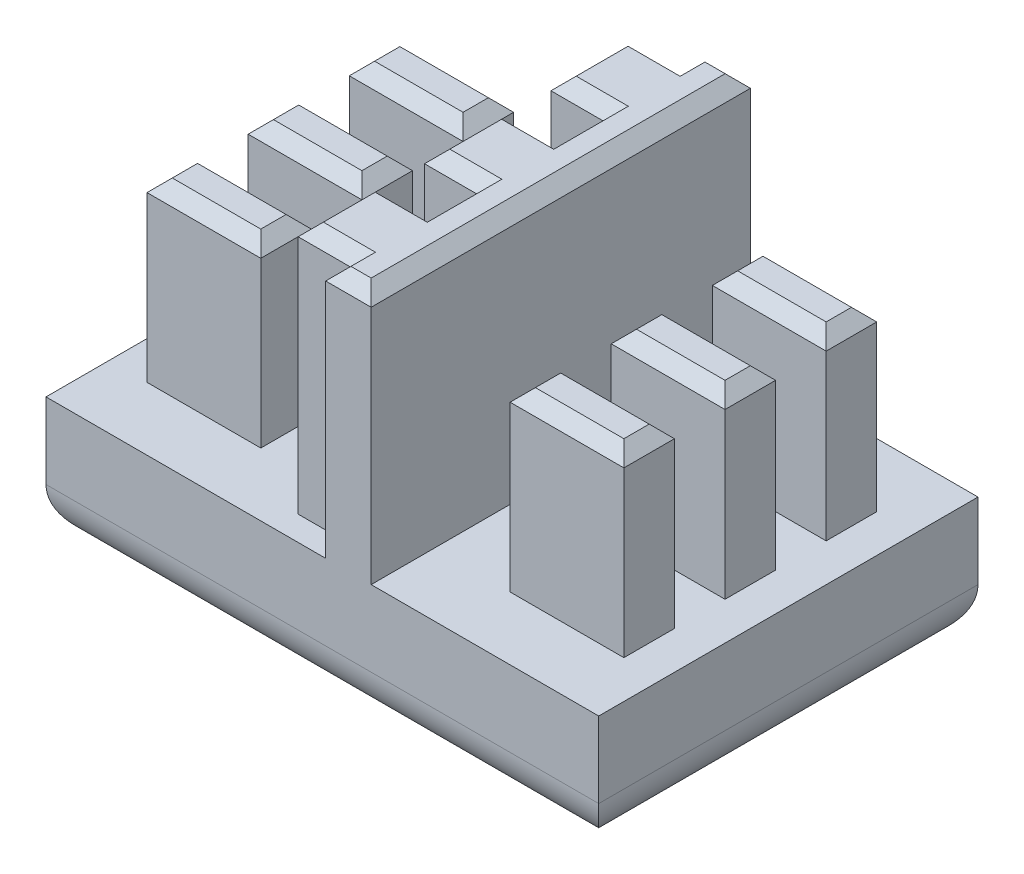
from build123d import *

# Parameters (mm, degrees)
EXTRUDE_1_DEPTH   = 7
SKETCH_1_W        = 4.5
SKETCH_1_H        = 2
EXTRUDE_1_2_DEPTH = 7
EXTRUDE_1_3_DEPTH = 7
EXTRUDE_1_4_DEPTH = 7
EXTRUDE_1_5_DEPTH = 7
EXTRUDE_1_6_DEPTH = 7
EXTRUDE_1_7_DEPTH = 7
EXTRUDE_2_DEPTH   = 3
SKETCH_3_W        = 21.86
SKETCH_3_H        = 15
EXTRUDE_3_DEPTH   = 5
FILLET_1_R        = 2
CHAMFER_1_SIZE    = 0.5


with BuildPart() as part:
    # 草图1 → 凸台-拉伸1 (new body)
    with BuildSketch(Plane(origin=(0, 0, 0), x_dir=(1, 0, 0), z_dir=(0, 1, 0))):
        Polygon((-0.13, 3.475), (-0.13, 1.525), (-2.19, 1.525), (-2.19, -1.525), (-0.13, -1.525), (-0.13, -3.475), (-2.19, -3.475), (-2.19, -6.525), (-0.13, -6.525), (-0.13, -7.495), (1.67, -7.495), (1.67, 7.505), (-0.13, 7.505), (-0.13, 6.525), (-2.19, 6.525), (-2.19, 3.475), align=None)
    extrude(amount=EXTRUDE_1_DEPTH)

    # 草图2 → 凸台-拉伸2 (add)
    with BuildSketch(Plane(origin=(0, 7, 0), x_dir=(1, 0, 0), z_dir=(0, 1, 0))):
        Polygon((-0.13, 7.505), (-0.13, 6.525), (-2.19, 6.525), (-2.19, 3.475), (-0.13, 3.475), (-0.13, 1.525), (-2.19, 1.525), (-2.19, -1.525), (-0.13, -1.525), (-0.13, -3.475), (-2.19, -3.475), (-2.19, -6.525), (-0.13, -6.525), (-0.13, -7.495), (1.67, -7.495), (1.67, 7.505), align=None)
    extrude(amount=EXTRUDE_2_DEPTH)



with BuildPart() as body_2:
    # 草图1 → Extrude 1 2 (new body)
    with BuildSketch(Plane(origin=(0, 0, 0), x_dir=(1, 0, 0), z_dir=(0, 1, 0))):
        with Locations((-7.44, 4)):
            Rectangle(SKETCH_1_W, SKETCH_1_H)
    extrude(amount=EXTRUDE_1_2_DEPTH)


with BuildPart() as body_3:
    # 草图1 → Extrude 1 3 (new body)
    with BuildSketch(Plane(origin=(0, 0, 0), x_dir=(1, 0, 0), z_dir=(0, 1, 0))):
        with Locations((-7.44, 0)):
            Rectangle(SKETCH_1_W, SKETCH_1_H)
    extrude(amount=EXTRUDE_1_3_DEPTH)


with BuildPart() as body_4:
    # 草图1 → Extrude 1 4 (new body)
    with BuildSketch(Plane(origin=(0, 0, 0), x_dir=(1, 0, 0), z_dir=(0, 1, 0))):
        with Locations((-7.44, -4)):
            Rectangle(SKETCH_1_W, SKETCH_1_H)
    extrude(amount=EXTRUDE_1_4_DEPTH)


with BuildPart() as body_5:
    # 草图1 → Extrude 1 5 (new body)
    with BuildSketch(Plane(origin=(0, 0, 0), x_dir=(1, 0, 0), z_dir=(0, 1, 0))):
        with Locations((6.92, 4)):
            Rectangle(SKETCH_1_W, SKETCH_1_H)
    extrude(amount=EXTRUDE_1_5_DEPTH)


with BuildPart() as body_6:
    # 草图1 → Extrude 1 6 (new body)
    with BuildSketch(Plane(origin=(0, 0, 0), x_dir=(1, 0, 0), z_dir=(0, 1, 0))):
        with Locations((6.92, 0)):
            Rectangle(SKETCH_1_W, SKETCH_1_H)
    extrude(amount=EXTRUDE_1_6_DEPTH)


with BuildPart() as body_7:
    # 草图1 → Extrude 1 7 (new body)
    with BuildSketch(Plane(origin=(0, 0, 0), x_dir=(1, 0, 0), z_dir=(0, 1, 0))):
        with Locations((6.92, -4)):
            Rectangle(SKETCH_1_W, SKETCH_1_H)
    extrude(amount=EXTRUDE_1_7_DEPTH)


with BuildPart() as part_1:
    add(part.part)

    add(body_2.part)  # 凸台-拉伸3 merges body 2

    add(body_3.part)  # 凸台-拉伸3 merges body 3

    add(body_4.part)  # 凸台-拉伸3 merges body 4

    add(body_5.part)  # 凸台-拉伸3 merges body 5

    add(body_6.part)  # 凸台-拉伸3 merges body 6

    add(body_7.part)  # 凸台-拉伸3 merges body 7
    # 草图3 → 凸台-拉伸3 (add)
    with BuildSketch(Plane.XZ):
        with Locations((-0.26, -0.005)):
            Rectangle(SKETCH_3_W, SKETCH_3_H)
    extrude(amount=EXTRUDE_3_DEPTH)

    # 圆角1
    fillet_1_edges = [part_1.edges().sort_by_distance(p)[0] for p in [
        (-11.19, -5, -0.005),
        (-0.26, -5, -7.505),
        (10.67, -5, -0.005),
        (-0.26, -5, 7.495),
    ]]
    fillet(fillet_1_edges, radius=FILLET_1_R)

    # 倒角1
    chamfer_1_edges = [part_1.edges().sort_by_distance(p)[0] for p in [
        (-5.19, 7, -4),
        (-7.44, 7, -5),
        (-9.69, 7, 0),
        (-7.44, 7, 1),
        (-5.19, 7, 0),
        (-7.44, 7, -1),
        (-9.69, 7, 4),
        (-7.44, 7, 5),
        (-5.19, 7, 4),
        (-7.44, 7, 3),
        (-9.69, 7, -4),
        (4.67, 7, -4),
        (6.92, 7, -3),
        (9.17, 7, -4),
        (6.92, 7, -5),
        (4.67, 7, 0),
        (6.92, 7, 1),
        (9.17, 7, 0),
        (6.92, 7, -1),
        (9.17, 7, 4),
        (6.92, 7, 3),
        (4.67, 7, 4),
        (6.92, 7, 5),
        (-7.44, 7, -3),
        (0.77, 10, -7.505),
        (-0.13, 10, -7.015),
        (-1.16, 10, -6.525),
        (-2.19, 10, -5),
        (-1.16, 10, -3.475),
        (-0.13, 10, -2.5),
        (-1.16, 10, -1.525),
        (-2.19, 10, 0),
        (-1.16, 10, 1.525),
        (-0.13, 10, 2.5),
        (-1.16, 10, 3.475),
        (-2.19, 10, 5),
        (-1.16, 10, 6.525),
        (-0.13, 10, 7.01),
        (0.77, 10, 7.495),
        (1.67, 10, -0.005),
    ]]
    chamfer(chamfer_1_edges, length=CHAMFER_1_SIZE)


solid = part_1.part
